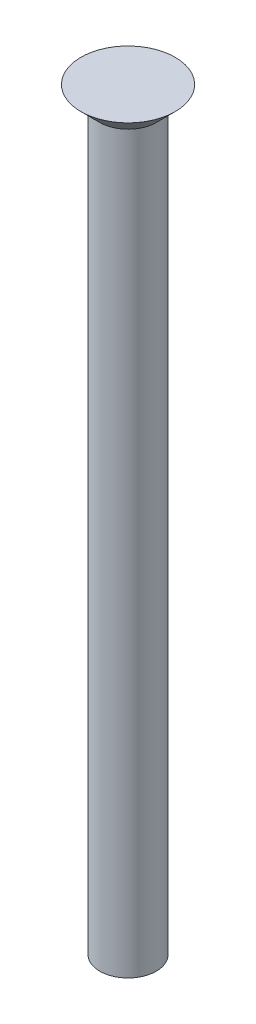
from build123d import *


with BuildPart() as part:
    # vf → Revolve1 (revolve)
    with BuildSketch(Plane.XY, mode=Mode.PRIVATE) as revolve1_sk:
        Polygon((0, 40), (-2.5, 40), (-1.5, 39), (-1.5, 0), (0, 0), align=None)
    revolve(revolve1_sk.sketch.rotate(Axis((0, 0, 0), (0, 1, 0)), 270), axis=Axis((0, 0, 0), (0, 1, 0)))


solid = part.part
